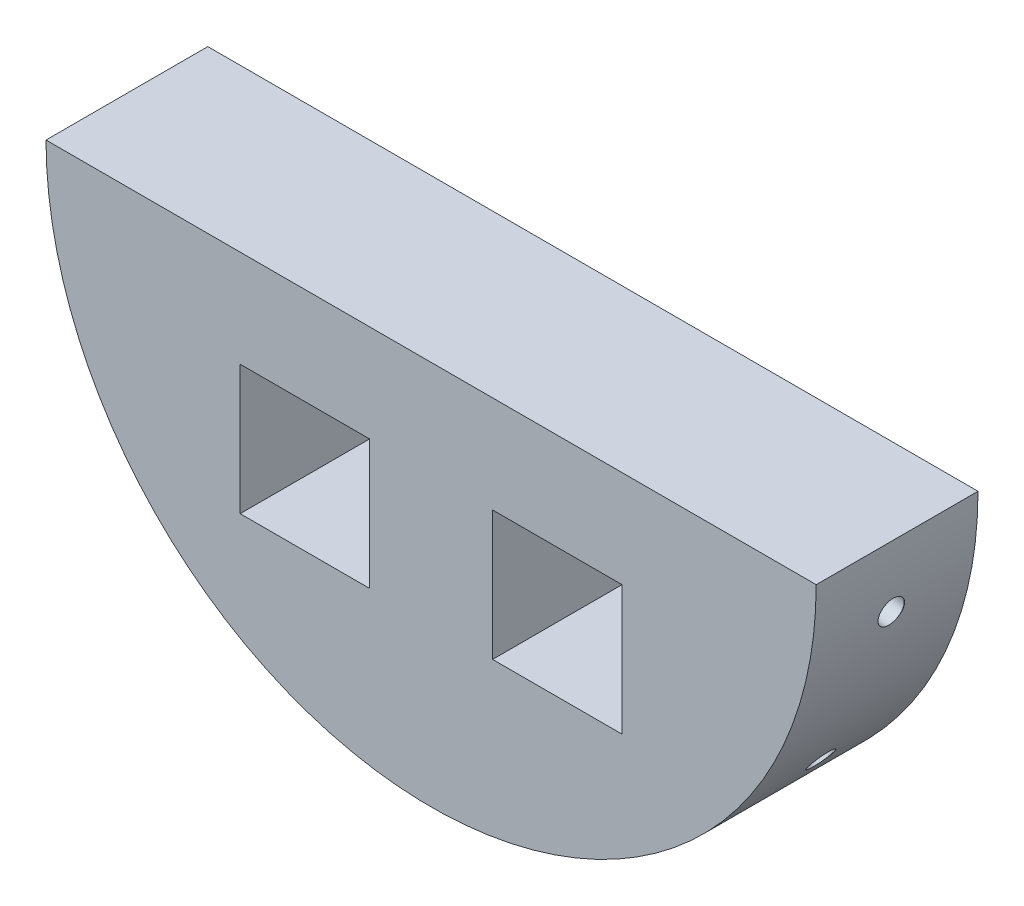
from build123d import *

# Parameters (mm, degrees)
SKETCH1_W           = 20
SKETCH1_H           = 20
BOSS_EXTRUDE1_DEPTH = 25
CIRPATTERN1_COUNT   = 7
CIRPATTERN1_ANGLE   = 160


with BuildPart() as part:
    # Sketch1 → Boss-Extrude1 (new body)
    with BuildSketch(Plane.XY):
        with BuildLine():
            Line((-119, 0), (0, 0))
            ThreePointArc((0, 0), (-59.5, -59.5), (-119, 0))
        make_face()
        with Locations((-40, -25)):
            Rectangle(SKETCH1_W, SKETCH1_H, mode=Mode.SUBTRACT)
        with Locations((-79, -25)):
            Rectangle(SKETCH1_W, SKETCH1_H, mode=Mode.SUBTRACT)
    extrude(amount=BOSS_EXTRUDE1_DEPTH)

    # Sketch4 → Ø4.0mm Dowel Hole2 (revolve, cut)
    with BuildSketch(Plane(origin=(-0.903938696, -10.332066571, 12.5), x_dir=(0.1736481776669305, 0.9848077530122081, 0), z_dir=(0, 0, 1))):
        Polygon((0, 0), (0, 11.201721238), (2, 10), (2, 0.025), (2.025, 0), align=None)
    f_4_0mm_dowel_hole2 = revolve(axis=Axis((5.349590536, -11.434732499, 12.5), (-0.9848077530122081, 0.1736481776669305, 0)), mode=Mode.SUBTRACT)

    # CirPattern1: Ø4.0mm Dowel Hole2 ×7 about axis
    cirpattern1_axis = Axis((-59.5, 0, 0), (0, 0, -1))
    for i in range(1, CIRPATTERN1_COUNT):
        add(f_4_0mm_dowel_hole2.rotate(cirpattern1_axis, i * CIRPATTERN1_ANGLE / (CIRPATTERN1_COUNT - 1)), mode=Mode.SUBTRACT)


solid = part.part
